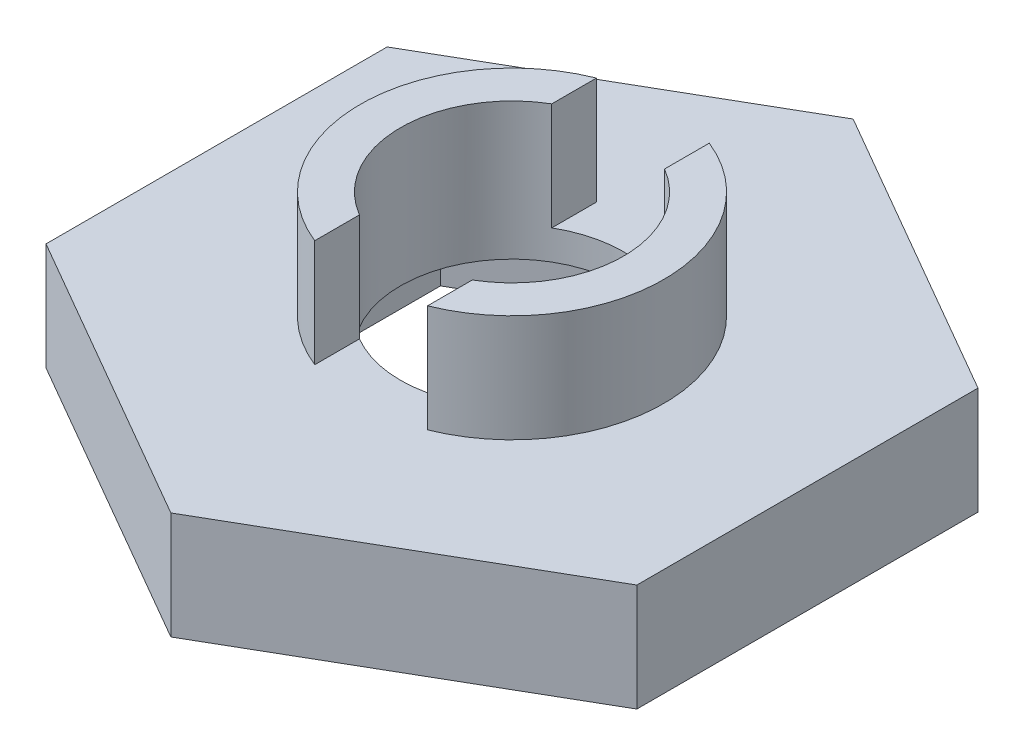
from build123d import *

# Parameters (mm, degrees)
SKETCH_1_R          = 5.65
SKETCH_1_R_2        = 4.15
EXTRUDE_1_DEPTH     = 8
SKETCH_1_3_R        = 11
SKETCH_1_3_R_2      = 5.65
EXTRUDE_2_DEPTH     = 4
CUT_EXTRUDE_1_DEPTH = 2.9
CUT_EXTRUDE_START   = -4
CUT_EXTRUDE_3_DEPTH = 4
EXTRUDE_4_DEPTH     = 4


with BuildPart() as part:
    # 草图1 → 凸台-拉伸1 (new body)
    with BuildSketch(Plane(origin=(0, 0, 0), x_dir=(1, 0, 0), z_dir=(0, 1, 0))):
        with Locations(Location((0, 0, 0), (0, 0, 270))):
            Circle(SKETCH_1_R)
        with Locations(Location((0, 0, 0), (0, 0, 270))):
            Circle(SKETCH_1_R_2, mode=Mode.SUBTRACT)
    extrude(amount=EXTRUDE_1_DEPTH)

    # 草图1<3> → 凸台-拉伸2 (add)
    with BuildSketch(Plane(origin=(0, 0, 0), x_dir=(1, 0, 0), z_dir=(0, 1, 0))):
        with Locations(Location((0, 0, 0), (0, 0, 270))):
            Circle(SKETCH_1_3_R)
        with Locations(Location((0, 0, 0), (0, 0, 270))):
            Circle(SKETCH_1_3_R_2, mode=Mode.SUBTRACT)
    extrude(amount=EXTRUDE_2_DEPTH)

    # 草图2 → 切除-拉伸1 (cut)
    with BuildSketch(Plane.XZ):
        Polygon((0, -7.274613392), (-6.3, -3.637306696), (-6.3, 3.637306696), (0, 7.274613392), (6.3, 3.637306696), (6.3, -3.637306696), align=None)
    extrude(amount=-CUT_EXTRUDE_1_DEPTH, mode=Mode.SUBTRACT)

    # 草图4 → 切除-拉伸3 (cut)
    with BuildSketch(Plane(origin=(0, 8, 0), x_dir=(1, 0, 0), z_dir=(0, 1, 0)).offset(CUT_EXTRUDE_START)):
        with BuildLine():
            Line((-2.1, 5.245235934), (-2.1, 3.579455266))
            ThreePointArc((-2.1, 3.579455266), (0, 4.15), (2.1, 3.579455266))
            Line((2.1, 3.579455266), (2.1, 5.245235934))
            ThreePointArc((2.1, 5.245235934), (0, 5.65), (-2.1, 5.245235934))
        make_face()
        with BuildLine():
            Line((2.1, -3.579455266), (2.1, -5.245235934))
            ThreePointArc((2.1, -5.245235934), (0, -5.65), (-2.1, -5.245235934))
            Line((-2.1, -5.245235934), (-2.1, -3.579455266))
            ThreePointArc((-2.1, -3.579455266), (0, -4.15), (2.1, -3.579455266))
        make_face()
    extrude(amount=CUT_EXTRUDE_3_DEPTH, mode=Mode.SUBTRACT)

    # 草图6 → 凸台-拉伸4 (add)
    with BuildSketch(Plane.XZ):
        with BuildLine():
            Line((5.500000491, -9.526279158), (11, -6.350852961))
            Line((11, -6.350852961), (11, 0))
            ThreePointArc((11, 0), (9.526279583, -5.499999755), (5.500000491, -9.526279158))
        make_face()
        with BuildLine():
            Line((0, -12.701705922), (5.500000491, -9.526279158))
            ThreePointArc((5.500000491, -9.526279158), (2.1e-08, -11), (-5.500000453, -9.52627918))
            Line((-5.500000453, -9.52627918), (0, -12.701705922))
        make_face()
        with BuildLine():
            Line((-11, -6.350852961), (-5.500000453, -9.52627918))
            ThreePointArc((-5.500000453, -9.52627918), (-9.526279573, -5.499999773), (-11, 0))
            Line((-11, 0), (-11, -6.350852961))
        make_face()
        with BuildLine():
            ThreePointArc((-11, 0), (-9.526279572, 5.499999775), (-5.50000045, 9.526279182))
            Line((-5.50000045, 9.526279182), (-11, 6.350852961))
            Line((-11, 6.350852961), (-11, 0))
        make_face()
        with BuildLine():
            ThreePointArc((-5.50000045, 9.526279182), (9.6e-08, 11), (5.500000616, 9.526279086))
            Line((5.500000616, 9.526279086), (0, 12.701705922))
            Line((0, 12.701705922), (-5.50000045, 9.526279182))
        make_face()
        with BuildLine():
            ThreePointArc((5.500000616, 9.526279086), (9.526279619, 5.499999692), (11, 0))
            Line((11, 0), (11, 6.350852961))
            Line((11, 6.350852961), (5.500000616, 9.526279086))
        make_face()
    extrude(amount=-EXTRUDE_4_DEPTH)


solid = part.part
